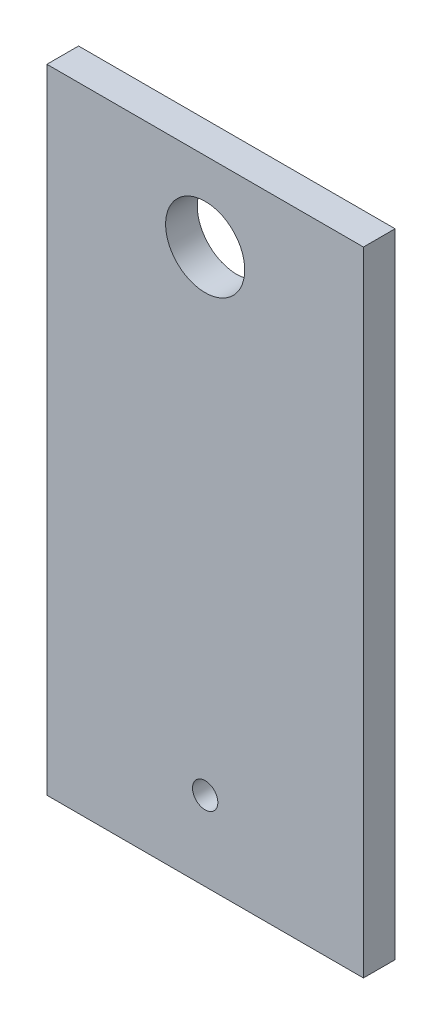
from build123d import *

# Parameters (mm, degrees)
SKETCH1_W           = 100
SKETCH1_H           = 200
BOSS_EXTRUDE1_DEPTH = 10
SKETCH3_R           = 4
CUT_EXTRUDE2_DEPTH  = 113.249721603
SKETCH4_R           = 4
CUT_EXTRUDE3_DEPTH  = 113.249721603
SKETCH5_R           = 12.5
CUT_EXTRUDE4_DEPTH  = 113.249721603


with BuildPart() as part:
    # Sketch1 → Boss-Extrude1 (new body)
    with BuildSketch(Plane.XY):
        Rectangle(SKETCH1_W, SKETCH1_H)
    extrude(amount=BOSS_EXTRUDE1_DEPTH)

    # Sketch3 → Cut-Extrude2 (cut, through all)
    with BuildSketch(Plane.XY.offset(10)):
        with Locations((0, -75)):
            Circle(SKETCH3_R)
    extrude(amount=-CUT_EXTRUDE2_DEPTH, mode=Mode.SUBTRACT)

    # Sketch4 → Cut-Extrude3 (cut, through all)
    with BuildSketch(Plane.XY.offset(10)):
        with Locations((0, 75)):
            Circle(SKETCH4_R)
    extrude(amount=-CUT_EXTRUDE3_DEPTH, mode=Mode.SUBTRACT)

    # Sketch5 → Cut-Extrude4 (cut, through all)
    with BuildSketch(Plane.XY.offset(10)):
        with Locations((0, 75)):
            Circle(SKETCH5_R)
    extrude(amount=-CUT_EXTRUDE4_DEPTH, mode=Mode.SUBTRACT)


solid = part.part
